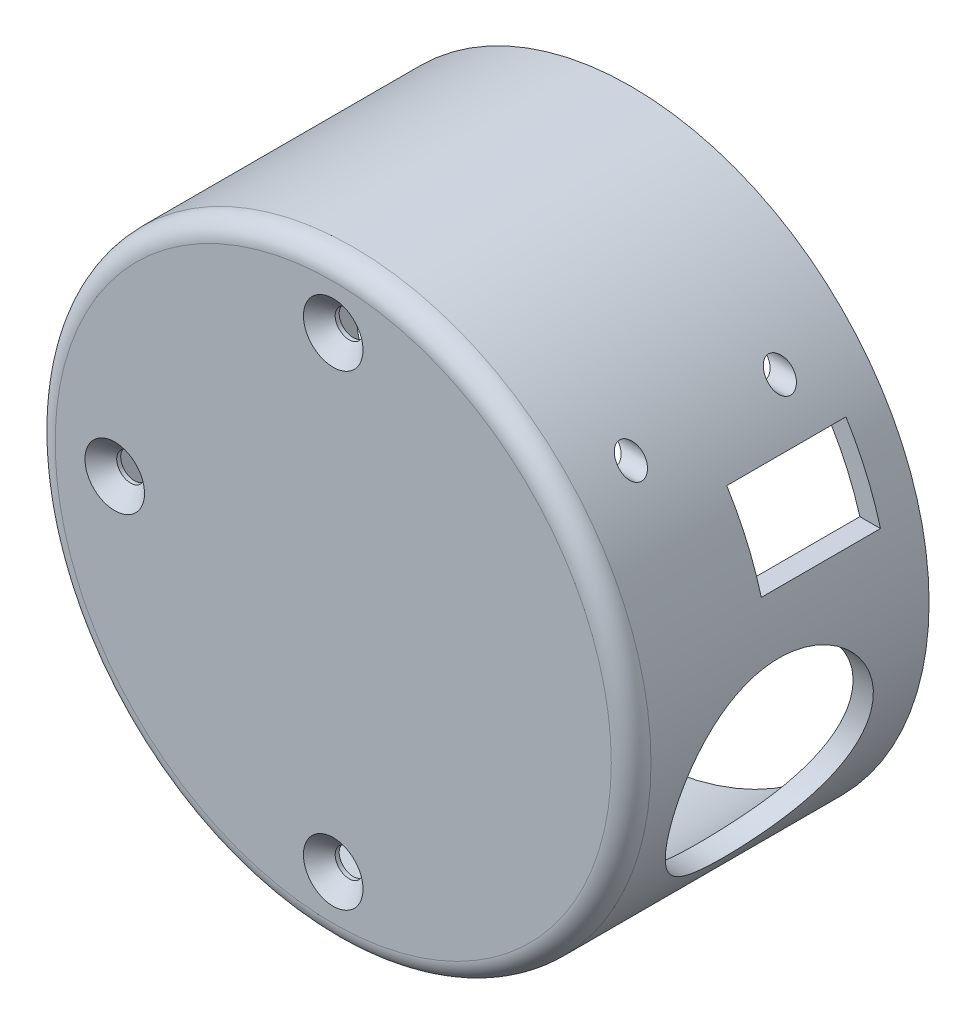
from build123d import *

# Parameters (mm, degrees)
CROQUIS1_R              = 30
SALIENTE_EXTRUIR1_DEPTH = 30
VACIADO1_T              = -2
REDONDEO1_R             = 2
CORTAR_EXTRUIR1_REACH   = 75.485
CROQUIS3_R              = 10.1
CORTAR_EXTRUIR2_REACH   = 53.962
CROQUIS5_R              = 1.4
CHAFL_N1_SIZE           = 1.6
CROQUIS11_R             = 1.25
CROQUIS11_W             = 12
CROQUIS11_H             = 8
CORTAR_EXTRUIR3_DEPTH   = 52.961524343


with BuildPart() as part:
    # Croquis1 → Saliente-Extruir1 (new body)
    with BuildSketch(Plane.XY):
        Circle(CROQUIS1_R)
    extrude(amount=SALIENTE_EXTRUIR1_DEPTH)

    # Vaciado1
    vaciado1_openings = [part.faces().sort_by_distance(p)[0] for p in [
        (0, 0, 0),
    ]]
    offset(amount=VACIADO1_T, openings=vaciado1_openings, kind=Kind.INTERSECTION)

    # Redondeo1
    redondeo1_edges = [part.edges().sort_by_distance(p)[0] for p in [
        (-30, 0, 30),
        (-28, 0, 28),
    ]]
    fillet(redondeo1_edges, radius=REDONDEO1_R)

    # Croquis3 → Cortar-Extruir1 (cut, up to next)
    with BuildSketch(Plane(origin=(30, 0, 30), x_dir=(0, 0, -1), z_dir=(1, 0, 0)), mode=Mode.PRIVATE) as cortar_extruir1_sk1:
        with Locations((15, -7.5)):
            Circle(CROQUIS3_R)
    cortar_extruir1_tool1 = extrude(cortar_extruir1_sk1.sketch, amount=-CORTAR_EXTRUIR1_REACH, mode=Mode.PRIVATE) & part.part
    add(cortar_extruir1_tool1.solids().sort_by_distance((30, -7.5, 15))[0], mode=Mode.SUBTRACT)

    # Croquis5 → Cortar-Extruir2 (cut, up to next)
    with BuildSketch(Plane.XY.offset(30), mode=Mode.PRIVATE) as cortar_extruir2_sk1:
        with Locations((0, 23.5)):
            Circle(CROQUIS5_R)
    cortar_extruir2_tool1 = extrude(cortar_extruir2_sk1.sketch, amount=-CORTAR_EXTRUIR2_REACH, mode=Mode.PRIVATE) & part.part
    # Croquis5 → Cortar-Extruir2 (cut, up to next)
    with BuildSketch(Plane.XY.offset(30), mode=Mode.PRIVATE) as cortar_extruir2_sk2:
        with Locations((-22, 0)):
            Circle(CROQUIS5_R)
    cortar_extruir2_tool2 = extrude(cortar_extruir2_sk2.sketch, amount=-CORTAR_EXTRUIR2_REACH, mode=Mode.PRIVATE) & part.part
    # Croquis5 → Cortar-Extruir2 (cut, up to next)
    with BuildSketch(Plane.XY.offset(30), mode=Mode.PRIVATE) as cortar_extruir2_sk3:
        with Locations((0, -23.5)):
            Circle(CROQUIS5_R)
    cortar_extruir2_tool3 = extrude(cortar_extruir2_sk3.sketch, amount=-CORTAR_EXTRUIR2_REACH, mode=Mode.PRIVATE) & part.part
    add(cortar_extruir2_tool1.solids().sort_by_distance((0, 23.5, 30))[0], mode=Mode.SUBTRACT)
    add(cortar_extruir2_tool2.solids().sort_by_distance((-22, 0, 30))[0], mode=Mode.SUBTRACT)
    add(cortar_extruir2_tool3.solids().sort_by_distance((0, -23.5, 30))[0], mode=Mode.SUBTRACT)

    # Chaflán1
    chafl_n1_edges = [part.edges().sort_by_distance(p)[0] for p in [
        (-1.4, 23.5, 30),
        (-23.4, 0, 30),
        (-1.4, -23.5, 30),
    ]]
    chamfer(chafl_n1_edges, length=CHAFL_N1_SIZE)

    # Croquis11 → Cortar-Extruir3 (cut, through all)
    with BuildSketch(Plane(origin=(0, 0, 0), x_dir=(0, 0, -1), z_dir=(1, 0, 0))):
        with Locations(Location((-22.5, 19.842217067, 0), (0, 0, 180))):
            Circle(CROQUIS11_R)
        with Locations(Location((-7.5, 19.842217067, 0), (0, 0, 180))):
            Circle(CROQUIS11_R)
        with Locations((-9.85, 11.842217067)):
            Rectangle(CROQUIS11_W, CROQUIS11_H)
    extrude(amount=CORTAR_EXTRUIR3_DEPTH, mode=Mode.SUBTRACT)


solid = part.part
